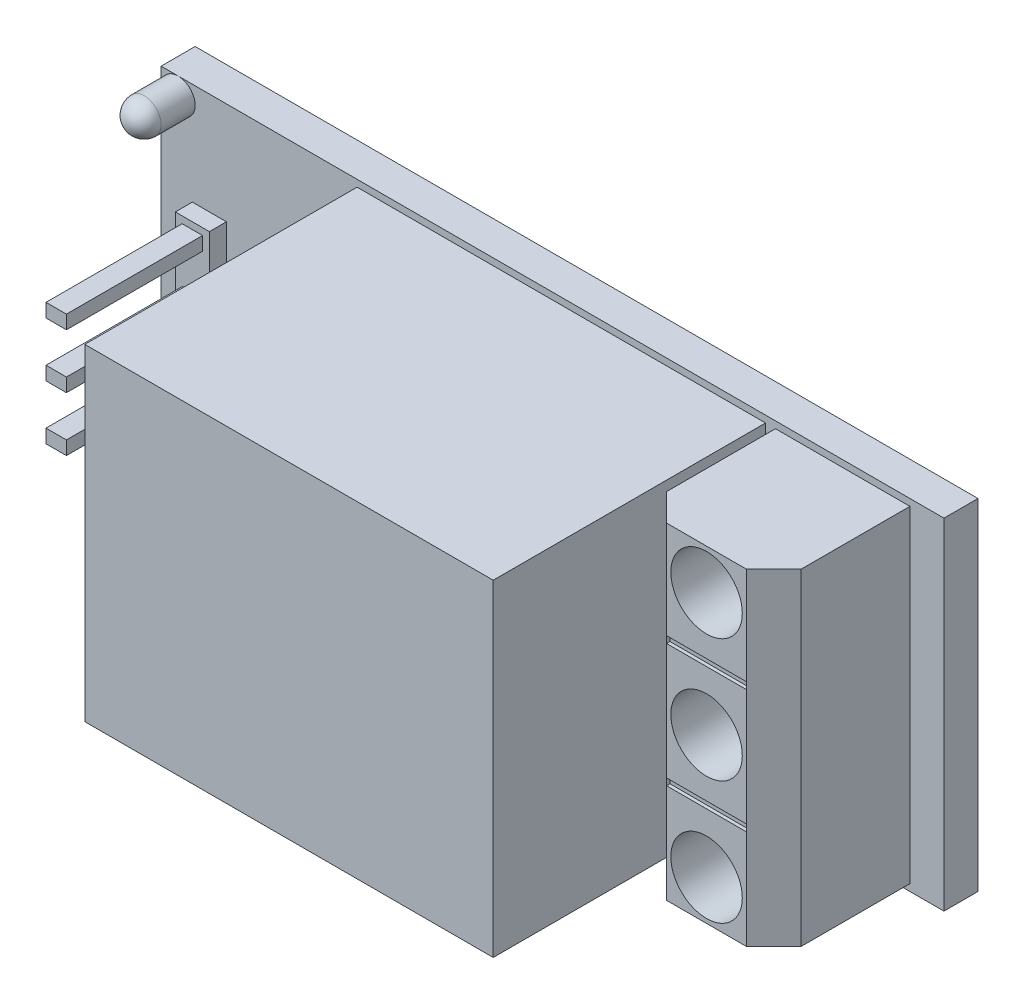
from build123d import *

# Parameters (mm, degrees)
SKETCH1_W           = 23
SKETCH1_H           = 10
BOSS_EXTRUDE1_DEPTH = 1
SKETCH2_W           = 3.95
SKETCH2_H           = 9.6
BOSS_EXTRUDE2_DEPTH = 4
SKETCH5_W           = 12
SKETCH5_H           = 9.6
BOSS_EXTRUDE3_DEPTH = 8
CUT_EXTRUDE1_REACH  = 28.571
SKETCH7_R           = 1.05
CUT_EXTRUDE3_DEPTH  = 1.5
SKETCH9_W           = 2.35
SKETCH9_H           = 0.2
CUT_EXTRUDE4_DEPTH  = 0.1
SKETCH10_W          = 1
SKETCH10_H          = 4
BOSS_EXTRUDE4_DEPTH = 0.5
SKETCH11_W          = 0.6
SKETCH11_H          = 0.4
BOSS_EXTRUDE5_DEPTH = 4
SKETCH12_R          = 0.5
BOSS_EXTRUDE6_DEPTH = 1.5
FILLET3_R           = 0.5


with BuildPart() as part:
    # Sketch1 → Boss-Extrude1 (new body)
    with BuildSketch(Plane.XY):
        with Locations((11.5, -5)):
            Rectangle(SKETCH1_W, SKETCH1_H)
    extrude(amount=BOSS_EXTRUDE1_DEPTH)

    # Sketch2 → Boss-Extrude2 (add)
    with BuildSketch(Plane.XY.offset(1)):
        with Locations((20.025, -5)):
            Rectangle(SKETCH2_W, SKETCH2_H)
    extrude(amount=BOSS_EXTRUDE2_DEPTH)

    # Sketch5 → Boss-Extrude3 (add)
    with BuildSketch(Plane.XY.offset(1)):
        with Locations((11.757840523, -5)):
            Rectangle(SKETCH5_W, SKETCH5_H)
    extrude(amount=BOSS_EXTRUDE3_DEPTH)

    # Sketch6 → Cut-Extrude1 (cut, up to next)
    with BuildSketch(Plane.XZ.offset(9.8), mode=Mode.PRIVATE) as cut_extrude1_sk1:
        Polygon((21.2, 5), (22, 4.2), (22, 5), align=None)
    cut_extrude1_tool1 = extrude(cut_extrude1_sk1.sketch, amount=-CUT_EXTRUDE1_REACH, mode=Mode.PRIVATE) & part.part
    # Sketch6 → Cut-Extrude1 (cut, up to next)
    with BuildSketch(Plane.XZ.offset(9.8), mode=Mode.PRIVATE) as cut_extrude1_sk2:
        Polygon((18.05, 5), (18.85, 5), (18.05, 4.2), align=None)
    cut_extrude1_tool2 = extrude(cut_extrude1_sk2.sketch, amount=-CUT_EXTRUDE1_REACH, mode=Mode.PRIVATE) & part.part
    add(cut_extrude1_tool1.solids().sort_by_distance((21.733333, -9.8, 4.733333))[0], mode=Mode.SUBTRACT)
    add(cut_extrude1_tool2.solids().sort_by_distance((18.316667, -9.8, 4.733333))[0], mode=Mode.SUBTRACT)

    # Sketch7 → Cut-Extrude3 (cut)
    with BuildSketch(Plane.XY.offset(5)):
        with Locations((20.025, -8.625)):
            Circle(SKETCH7_R)
        with Locations((20.025, -5.005)):
            Circle(SKETCH7_R)
        with Locations((20.025, -1.385)):
            Circle(SKETCH7_R)
    extrude(amount=-CUT_EXTRUDE3_DEPTH, mode=Mode.SUBTRACT)

    # Sketch9 → Cut-Extrude4 (cut)
    with BuildSketch(Plane.XY.offset(5)):
        with Locations((20.025, -6.783672737)):
            Rectangle(SKETCH9_W, SKETCH9_H)
        with Locations((20.025, -3.163989789)):
            Rectangle(SKETCH9_W, SKETCH9_H)
    extrude(amount=-CUT_EXTRUDE4_DEPTH, mode=Mode.SUBTRACT)

    # Sketch10 → Boss-Extrude4 (add)
    with BuildSketch(Plane.XY.offset(1)):
        with Locations((1.418300491, -5)):
            Rectangle(SKETCH10_W, SKETCH10_H)
    extrude(amount=BOSS_EXTRUDE4_DEPTH)

    # Sketch11 → Boss-Extrude5 (add)
    with BuildSketch(Plane.XY.offset(1.5)):
        with Locations((1.418300491, -5)):
            Rectangle(SKETCH11_W, SKETCH11_H)
        with Locations((1.418300491, -3.4)):
            Rectangle(SKETCH11_W, SKETCH11_H)
        with Locations((1.418300491, -6.6)):
            Rectangle(SKETCH11_W, SKETCH11_H)
    extrude(amount=BOSS_EXTRUDE5_DEPTH)

    # Sketch12 → Boss-Extrude6 (add)
    with BuildSketch(Plane.XY.offset(1)):
        with Locations(Location((0.5, -9.5, 0), (0, 0, 180))):
            Circle(SKETCH12_R)
        with Locations(Location((0.5, -0.5, 0), (0, 0, 180))):
            Circle(SKETCH12_R)
    extrude(amount=BOSS_EXTRUDE6_DEPTH)

    # Fillet3
    fillet3_edges = [part.edges().sort_by_distance(p)[0] for p in [
        (1, -0.5, 2.5),
        (1, -9.5, 2.5),
    ]]
    fillet(fillet3_edges, radius=FILLET3_R)


solid = part.part
